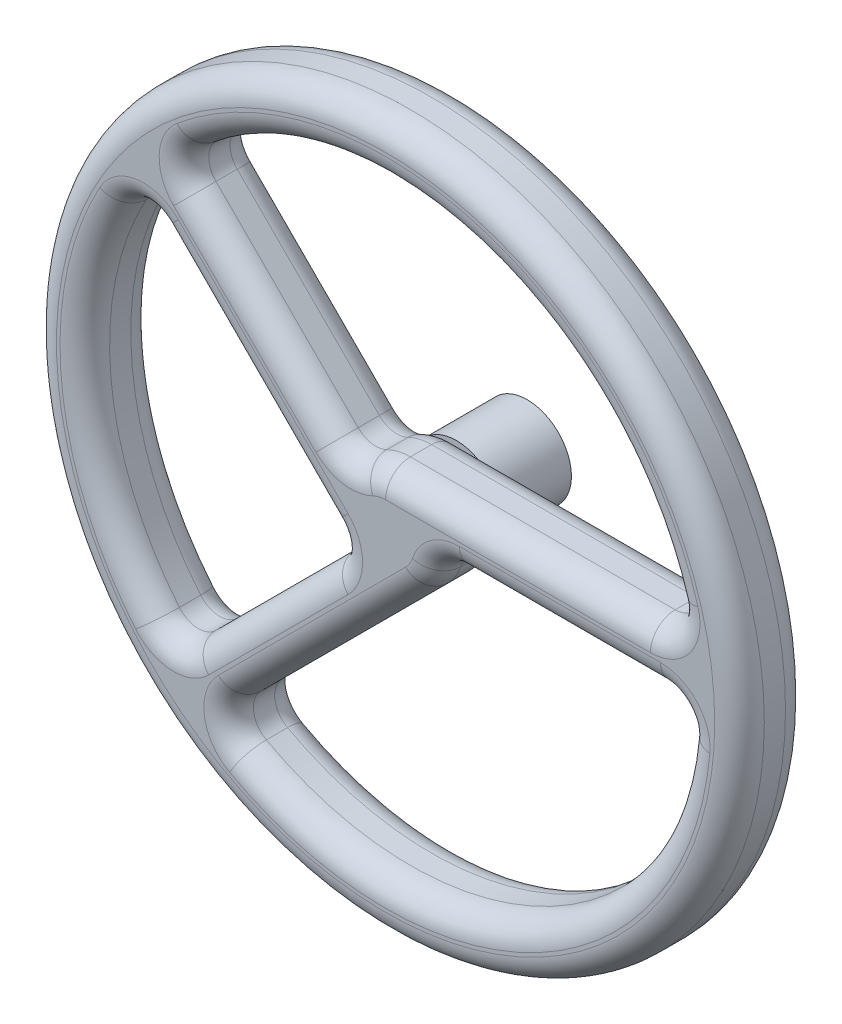
from build123d import *

# Parameters (mm, degrees)
SKETCH1_R           = 100
SKETCH1_R_2         = 15
BOSS_EXTRUDE1_DEPTH = 20
FILLET17_R          = 7
SKETCH2_R           = 12.5
BOSS_EXTRUDE2_DEPTH = 20


with BuildPart() as part:
    # Sketch1 → Boss-Extrude1 (new body)
    # profile 1 of 2: a face of its own
    with BuildSketch(Plane.XY):
        Circle(SKETCH1_R)
        with BuildLine():
            Line((-69.767399549, 48.554196113), (-10.606601718, -10.606601718))
            Line((-10.606601718, -10.606601718), (-60.104076401, -60.104076401))
            ThreePointArc((-60.104076401, -60.104076401), (-84.665843838, -7.529600735), (-69.767399549, 48.554196113))
        make_face(mode=Mode.SUBTRACT)
        with BuildLine():
            ThreePointArc((10.606601718, -10.606601718), (0, -15), (-10.606601718, -10.606601718))
            ThreePointArc((-10.606601718, -10.606601718), (-15, 0), (-10.606601718, 10.606601718))
            Line((-10.606601718, 10.606601718), (-60.104076401, 60.104076401))
            ThreePointArc((-60.104076401, 60.104076401), (25.443771717, 81.102493678), (83.666002653, 15))
            Line((83.666002653, 15), (0, 15))
            ThreePointArc((0, 15), (10.606601718, 10.606601718), (15, 0))
            Line((15, 0), (85, 0))
            ThreePointArc((85, 0), (39.356659731, -75.339586771), (-48.554196113, -69.767399549))
            Line((-48.554196113, -69.767399549), (10.606601718, -10.606601718))
        make_face(mode=Mode.SUBTRACT)
    # profile 2 of 2: a face of its own
    with BuildSketch(Plane.XY):
        Circle(SKETCH1_R_2)
    extrude(amount=BOSS_EXTRUDE1_DEPTH)

    # Fillet17
    fillet17_edges = [part.edges().sort_by_distance(p)[0] for p in [
        (-5.740251485, 13.858192988, 20),
        (-100, 0, 0),
        (-84.665843838, -7.529600735, 0),
        (-35.355339059, -35.355339059, 0),
        (-40.187000633, 18.973797198, 0),
        (39.356659731, -75.339586771, 0),
        (50, 0, 0),
        (13.858192988, -5.740251485, 0),
        (-35.355339059, 35.355339059, 20),
        (-18.973797198, -40.187000633, 0),
        (25.443771717, 81.102493678, 0),
        (-35.355339059, 35.355339059, 0),
        (-5.740251485, 13.858192988, 0),
        (41.833001327, 15, 0),
        (25.443771717, 81.102493678, 20),
        (-69.767399549, 48.554196113, 10),
        (-60.104076401, -60.104076401, 10),
        (-10.606601718, -10.606601718, 10),
        (-48.554196113, -69.767399549, 10),
        (85, 0, 10),
        (15, 0, 10),
        (83.666002653, 15, 10),
        (-60.104076401, 60.104076401, 10),
        (-10.606601718, 10.606601718, 10),
        (-18.973797198, -40.187000633, 20),
        (13.858192988, -5.740251485, 20),
        (50, 0, 20),
        (39.356659731, -75.339586771, 20),
        (-40.187000633, 18.973797198, 20),
        (-35.355339059, -35.355339059, 20),
        (-84.665843838, -7.529600735, 20),
        (-100, 0, 20),
        (41.833001327, 15, 20),
    ]]
    fillet(fillet17_edges, radius=FILLET17_R)

    # Sketch2 → Boss-Extrude2 (add)
    with BuildSketch(Plane(origin=(0, 0, 0), x_dir=(-1, 0, 0), z_dir=(0, 0, -1))):
        with Locations(Location((0, 0, 0), (0, 0, 162.427474987))):
            Circle(SKETCH2_R)
    extrude(amount=BOSS_EXTRUDE2_DEPTH)


solid = part.part
